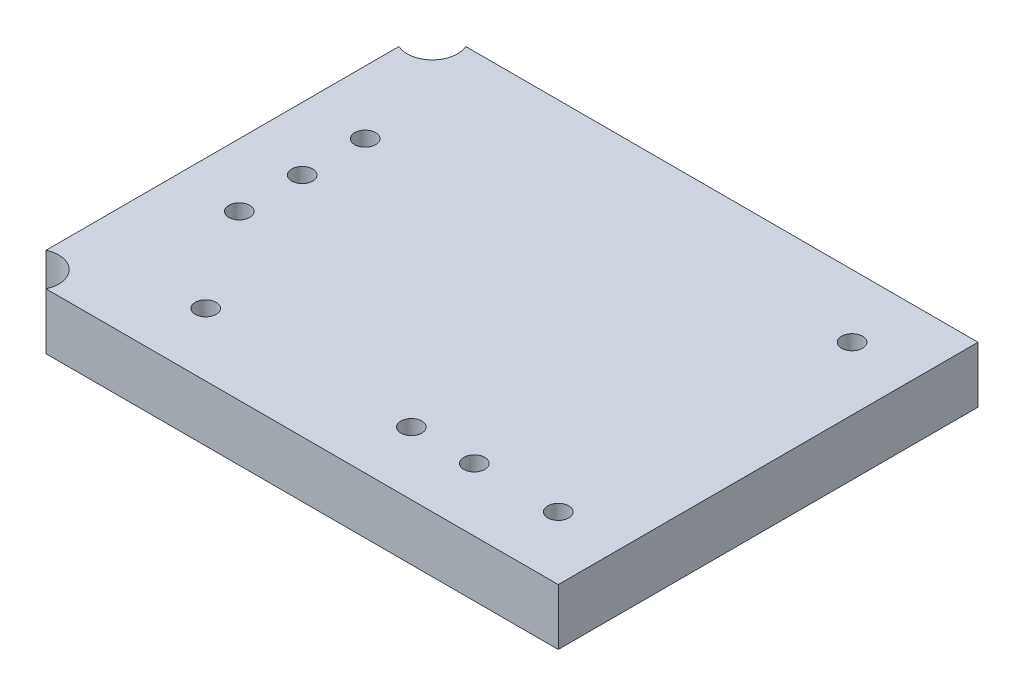
from build123d import *

# Parameters (mm, degrees)
BOSS_EXTRUDE1_DEPTH = 1.34
SKETCH2_R           = 0.25
CUT_EXTRUDE1_DEPTH  = 9.309368207


with BuildPart() as part:
    # Sketch1 → Boss-Extrude1 (new body)
    with BuildSketch(Plane(origin=(0, 0, 0), x_dir=(1, 0, 0), z_dir=(0, 1, 0))):
        with BuildLine():
            ThreePointArc((-5.704564394, 5), (-5.825735931, 4.325735931), (-6.5, 4.204564394))
            Line((-6.5, 4.204564394), (-6.5, -4.204564394))
            ThreePointArc((-6.5, -4.204564394), (-5.825735931, -4.325735931), (-5.704564394, -5))
            Line((-5.704564394, -5), (6.5, -5))
            Line((6.5, -5), (6.5, 5))
            Line((6.5, 5), (-5.704564394, 5))
        make_face()
    extrude(amount=BOSS_EXTRUDE1_DEPTH)

    # Sketch2 → Cut-Extrude1 (cut, through all)
    with BuildSketch(Plane(origin=(0, 1.34, 0), x_dir=(1, 0, 0), z_dir=(0, 1, 0))):
        with Locations(Location((-5, 1.9, 0), (0, 0, 270))):
            Circle(SKETCH2_R)
        with Locations(Location((-5, 0.4, 0), (0, 0, 270))):
            Circle(SKETCH2_R)
        with Locations(Location((-5, -1.1, 0), (0, 0, 270))):
            Circle(SKETCH2_R)
        with Locations(Location((5, 3.5, 0), (0, 0, 270))):
            Circle(SKETCH2_R)
        with Locations(Location((5, -3.5, 0), (0, 0, 270))):
            Circle(SKETCH2_R)
        with Locations(Location((3, -3.5, 0), (0, 0, 270))):
            Circle(SKETCH2_R)
        with Locations(Location((1.5, -3.5, 0), (0, 0, 270))):
            Circle(SKETCH2_R)
        with Locations(Location((-3.4, -3.5, 0), (0, 0, 270))):
            Circle(SKETCH2_R)
    extrude(amount=-CUT_EXTRUDE1_DEPTH, mode=Mode.SUBTRACT)


solid = part.part
